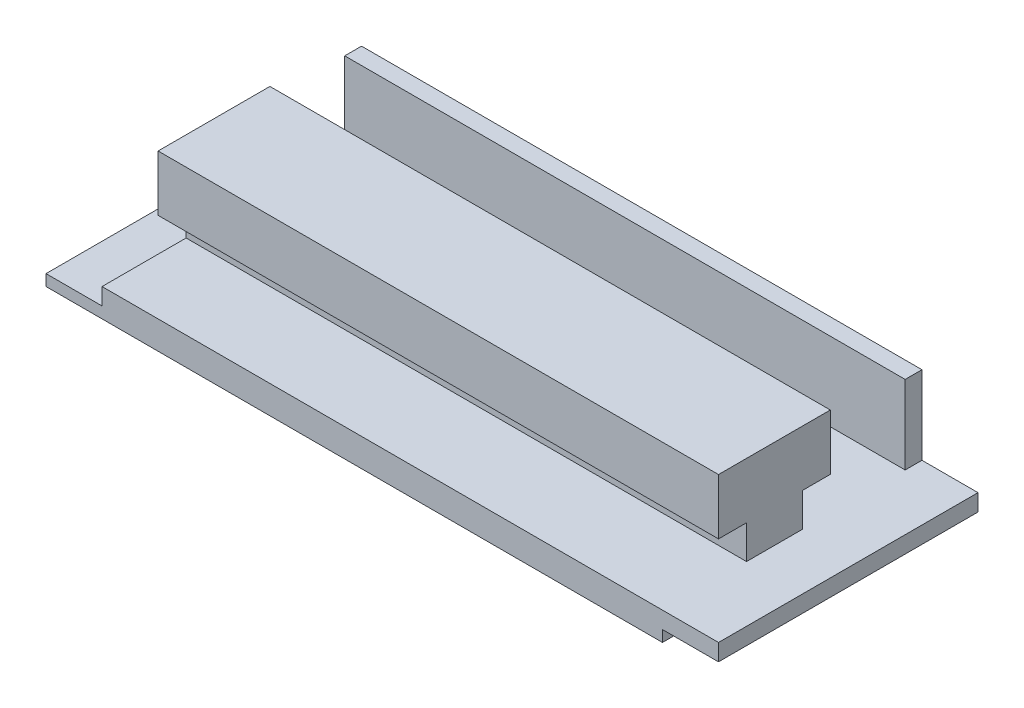
from build123d import *

# Parameters (mm, degrees)
SKETCH2_W           = 13
SKETCH2_H           = 5
BOSS_EXTRUDE1_DEPTH = 100
SKETCH4_W           = 46.302304271
SKETCH4_H           = 2
BOSS_EXTRUDE2_DEPTH = 10
BOSS_EXTRUDE4_DEPTH = 10


with BuildPart() as part:
    # Sketch2 → Boss-Extrude1 (new body)
    with BuildSketch(Plane(origin=(0, 5.94140841, 0), x_dir=(0, 0, -1), z_dir=(1, 0, 0))):
        Polygon((-0.588894188, 6), (4.411105812, 6), (4.411105812, 15.949875627), (-15.538894188, 15.949875627), (-15.538894188, 5.999875627), (-10.538894188, 5.999875627), (-10.538894188, 0), (-0.588894188, 0), align=None)
        Polygon((20.763410083, 14), (17.763410083, 14), (17.763410083, 0), (17.763410083, -5), (20.763410083, -5), align=None)
        Polygon((-0.588894188, 0), (4.763410083, 0), (4.763410083, -5), (-25.538894188, -5), (-25.538894188, 0), (-10.538894188, 0), align=None)
        with Locations((11.263410083, -2.5)):
            Rectangle(SKETCH2_W, SKETCH2_H)
    extrude(amount=BOSS_EXTRUDE1_DEPTH)

    # Sketch4 → Boss-Extrude2 (add)
    with BuildSketch(Plane.ZY):
        with Locations((2.387742053, 1.94140841)):
            Rectangle(SKETCH4_W, SKETCH4_H)
    extrude(amount=BOSS_EXTRUDE2_DEPTH)

    # Sketch5 → Boss-Extrude4 (add)
    with BuildSketch(Plane(origin=(100, 0, 0), x_dir=(0, 0, -1), z_dir=(1, 0, 0))):
        Polygon((-25.538894188, 5.94140841), (-25.538894188, 2.94140841), (20.763410083, 2.94140841), (20.763410083, 5.94140841), (17.763410083, 5.94140841), (-0.588894188, 5.94140841), (-10.538894188, 5.94140841), align=None)
    extrude(amount=BOSS_EXTRUDE4_DEPTH)


solid = part.part
